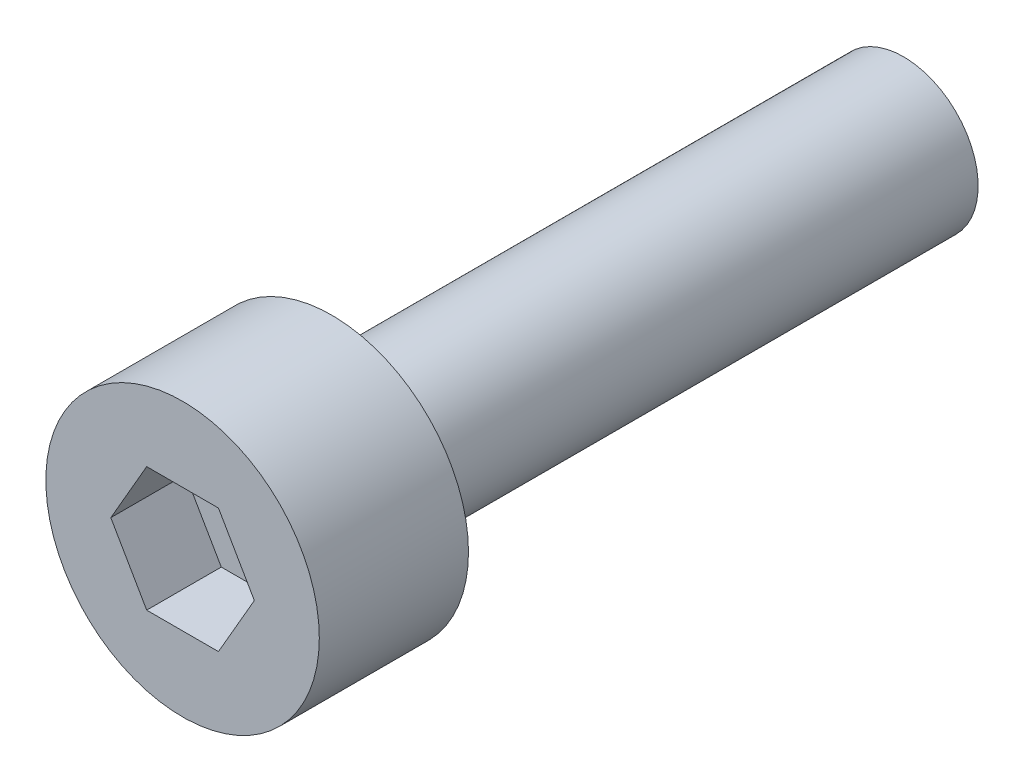
from build123d import *

# Parameters (mm, degrees)
SKETCH2_R           = 2.75
BOSS_EXTRUDE1_DEPTH = 3
SKETCH3_R           = 1.5
BOSS_EXTRUDE2_DEPTH = 11.5
CUT_EXTRUDE1_DEPTH  = 1.5


with BuildPart() as part:
    # Sketch2 → Boss-Extrude1 (new body)
    with BuildSketch(Plane.XY):
        Circle(SKETCH2_R)
    extrude(amount=BOSS_EXTRUDE1_DEPTH)

    # Sketch3 → Boss-Extrude2 (add)
    with BuildSketch(Plane(origin=(0, 0, 0), x_dir=(-1, 0, 0), z_dir=(0, 0, -1))):
        Circle(SKETCH3_R)
    extrude(amount=BOSS_EXTRUDE2_DEPTH)

    # Sketch4 → Cut-Extrude1 (cut)
    with BuildSketch(Plane.XY.offset(3)):
        Polygon((1.443375673, 0), (0.721687836, 1.25), (-0.721687836, 1.25), (-1.443375673, 0), (-0.721687836, -1.25), (0.721687836, -1.25), align=None)
    extrude(amount=-CUT_EXTRUDE1_DEPTH, mode=Mode.SUBTRACT)


solid = part.part
